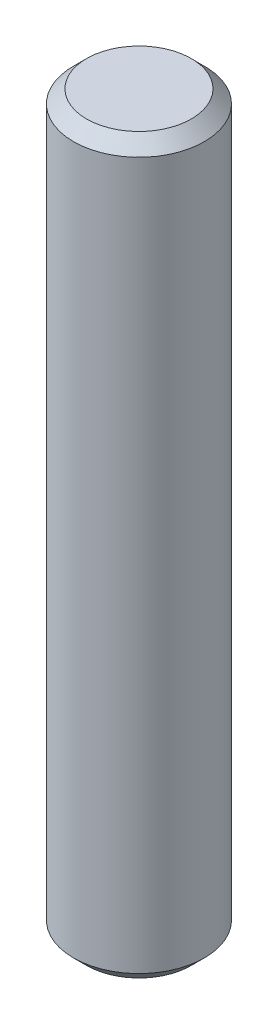
from build123d import *

# Parameters (mm, degrees)
AUFSATZ_LINEAR_AUSTRAGEN1_DEPTH      = 14
AUFSATZ_LINEAR_AUSTRAGEN1_DEPTH_BACK = 14
SKIZZE1_R                            = 2.5
FASE1_SIZE                           = 0.5


with BuildPart() as part:
    # Skizze1 → Aufsatz-Linear austragen1 (new, two sides: drawn at the far end of the back side and taken through both)
    with BuildSketch(Plane(origin=(0, 0, 0), x_dir=(1, 0, 0), z_dir=(0, 1, 0)).offset(-AUFSATZ_LINEAR_AUSTRAGEN1_DEPTH_BACK)):
        Circle(SKIZZE1_R)
    extrude(amount=AUFSATZ_LINEAR_AUSTRAGEN1_DEPTH + AUFSATZ_LINEAR_AUSTRAGEN1_DEPTH_BACK)

    # Fase1
    fase1_edges = [part.edges().sort_by_distance(p)[0] for p in [
        (-2.5, -14, 0),
        (-2.5, 14, 0),
    ]]
    chamfer(fase1_edges, length=FASE1_SIZE)


solid = part.part
